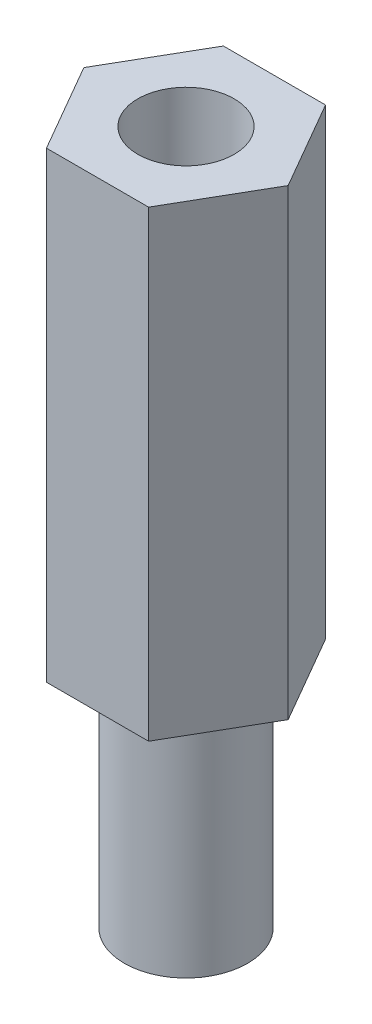
from build123d import *

# Parameters (mm, degrees)
EXTRUDE_1_DEPTH     = 12
SKETCH_6_R          = 1.6
EXTRUDE_2_DEPTH     = 6
SKETCH_7_R          = 1.25
CUT_EXTRUDE_1_DEPTH = 5


with BuildPart() as part:
    # 草图4 → 凸台-拉伸1 (new body)
    with BuildSketch(Plane(origin=(0, 0, 0), x_dir=(1, 0, 0), z_dir=(0, 1, 0))):
        Polygon((1.325, -2.29496732), (2.65, 0), (1.325, 2.29496732), (-1.325, 2.29496732), (-2.65, 0), (-1.325, -2.29496732), align=None)
    extrude(amount=EXTRUDE_1_DEPTH)

    # 草图6 → 凸台-拉伸2 (add)
    with BuildSketch(Plane(origin=(0, 0, 0), x_dir=(-1, 0, 0), z_dir=(0, -1, 0))):
        with Locations(Location((0, 0, 0), (0, 0, 270))):
            Circle(SKETCH_6_R)
    extrude(amount=EXTRUDE_2_DEPTH)

    # 草图7 → 切除-拉伸1 (cut)
    with BuildSketch(Plane(origin=(0, 12, 0), x_dir=(1, 0, 0), z_dir=(0, 1, 0))):
        with Locations(Location((0, 0, 0), (0, 0, 270))):
            Circle(SKETCH_7_R)
    extrude(amount=-CUT_EXTRUDE_1_DEPTH, mode=Mode.SUBTRACT)


solid = part.part
